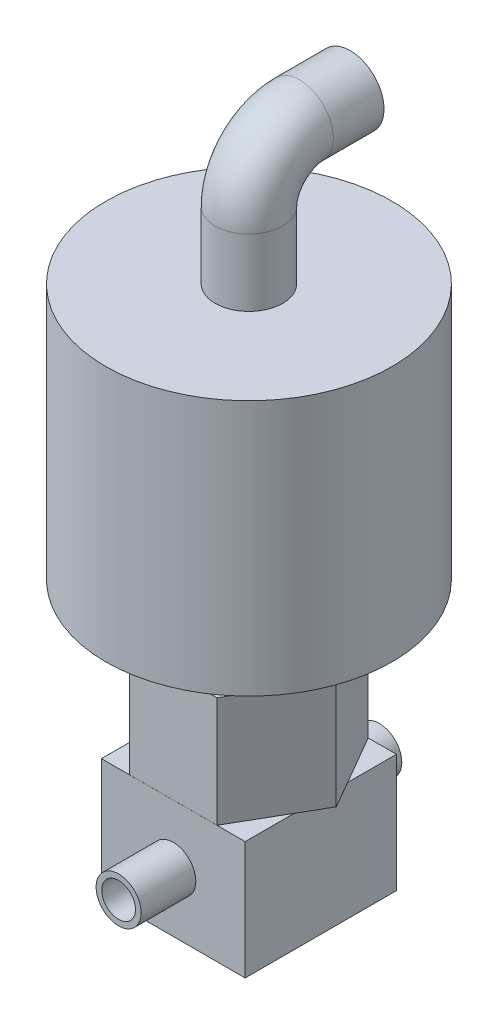
from build123d import *

# Parameters (mm, degrees)
SKETCH2_W         = 27.0256
SKETCH2_H         = 28.448
MOUNT_BLOCK_DEPTH = 22.2123
MID_HEX_DEPTH     = 20.7645
SKETCH4_R         = 4.233333333
SKETCH4_R_2       = 3.175
SWGLK_M_DEPTH     = 10.287
SKETCH6_R         = 6.35
SKETCH6_R_2       = 3.175
SKETCH7_R         = 2.05105
MOUNT_HOLES_DEPTH = 12.7


with BuildPart() as part:
    # Sketch1 → BASE (revolve)
    with BuildSketch(Plane(origin=(0, 0, 0), x_dir=(0, 0, -1), z_dir=(1, 0, 0)), mode=Mode.PRIVATE) as base_sk:
        Polygon((0, 0), (12.7, 0), (12.7, 22.2123), (14.21765, 22.2123), (14.21765, 42.9768), (9.4234, 42.9768), (9.4234, 51.0667), (26.924, 51.0667), (26.924, 99.1743), (0, 99.1743), align=None)
    revolve(base_sk.sketch.rotate(Axis((0, 0, 0), (0, -1, 0)), 180), axis=Axis((0, 0, 0), (0, -1, 0)))

    # Sketch2 → MOUNT_BLOCK (add)
    with BuildSketch(Plane.XZ):
        Rectangle(SKETCH2_W, SKETCH2_H)
    extrude(amount=-MOUNT_BLOCK_DEPTH)

    # Sketch3 → MID_HEX (add)
    with BuildSketch(Plane.XZ.offset(-22.2123)):
        Polygon((16.417128109, 0), (8.208564055, 14.21765), (-8.208564055, 14.21765), (-16.417128109, 0), (-8.208564055, -14.21765), (8.208564055, -14.21765), align=None)
    extrude(amount=-MID_HEX_DEPTH)

    # Sketch4 → SWGLK_M (add)
    with BuildSketch(Plane.XY.offset(14.224)):
        with Locations((0, 11.10615)):
            Circle(SKETCH4_R)
        with Locations((0, 11.10615)):
            Circle(SKETCH4_R_2, mode=Mode.SUBTRACT)
    swglk_m = extrude(amount=SWGLK_M_DEPTH)

    # SWGLK_M_MRR: SWGLK_M across plane
    add(swglk_m.mirror(Plane.XY))

    # PRESS_QD: sweep along a path in Sketch5
    with BuildLine(Plane(origin=(0, 0, 0), x_dir=(0, 0, -1), z_dir=(1, 0, 0))) as press_qd_path:
        Line((0, 99.1743), (0, 111.76762))
        ThreePointArc((0, 111.76762), (2.789807909, 118.502812091), (9.525, 121.29262))
        Line((9.525, 121.29262), (19.05, 121.29262))
    # Sketch6 → PRESS_QD (sweep)
    with BuildSketch(Plane(origin=(0, 99.1743, 0), x_dir=(1, 0, 0), z_dir=(0, 1, 0))):
        Circle(SKETCH6_R)
        Circle(SKETCH6_R_2, mode=Mode.SUBTRACT)
    sweep(path=press_qd_path.line)

    # Sketch7 → MOUNT_HOLES (cut)
    with BuildSketch(Plane.XZ):
        with Locations(Location((-8.296007071, -9.60755, 0), (0, 0, 270))):
            Circle(SKETCH7_R)
        with Locations(Location((8.296007071, 9.60755, 0), (0, 0, 270))):
            Circle(SKETCH7_R)
    extrude(amount=-MOUNT_HOLES_DEPTH, mode=Mode.SUBTRACT)


solid = part.part
